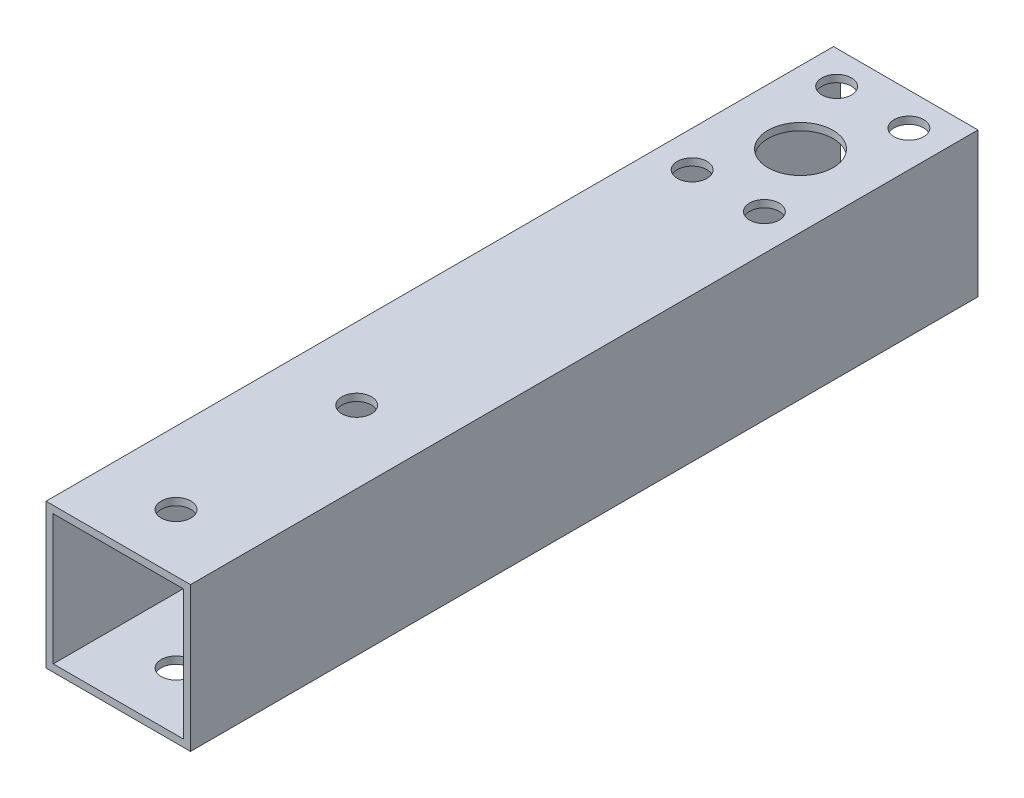
from build123d import *

# Parameters (mm, degrees)
SKETCH_1_2_W         = 20
SKETCH_1_2_H         = 20
SKETCH_1_2_W_2       = 18
SKETCH_1_2_H_2       = 18
EXTRUDE_2_DEPTH      = 54.5
SKETCH_2_R           = 2.05
CUT_EXTRUDE_1_DEPTH  = 102
SKETCH_11_R          = 2.05
CUT_EXTRUDE_8_DEPTH  = 50
SKETCH_17_R          = 4.5
CUT_EXTRUDE_14_DEPTH = 40


with BuildPart() as part:
    # 草图1<2> → 凸台-拉伸2 (new, symmetric)
    with BuildSketch(Plane.XY):
        Rectangle(SKETCH_1_2_W, SKETCH_1_2_H)
        Rectangle(SKETCH_1_2_W_2, SKETCH_1_2_H_2, mode=Mode.SUBTRACT)
    extrude(amount=EXTRUDE_2_DEPTH, both=True)

    # 草图2 → 切除-拉伸1 (cut)
    with BuildSketch(Plane(origin=(0, 10, 0), x_dir=(1, 0, 0), z_dir=(0, 1, 0))):
        with Locations((0, -46.5)):
            Circle(SKETCH_2_R)
        with Locations((0, -21.5)):
            Circle(SKETCH_2_R)
    extrude(amount=-CUT_EXTRUDE_1_DEPTH, mode=Mode.SUBTRACT)

    # 草图11 → 切除-拉伸8 (cut)
    with BuildSketch(Plane(origin=(0, 10, 0), x_dir=(1, 0, 0), z_dir=(0, 1, 0))):
        with Locations((5, 29.933387088)):
            Circle(SKETCH_11_R)
        with Locations((-5, 29.933387088)):
            Circle(SKETCH_11_R)
        with Locations((5, 49.933387088)):
            Circle(SKETCH_11_R)
        with Locations((-5, 49.933387088)):
            Circle(SKETCH_11_R)
    extrude(amount=-CUT_EXTRUDE_8_DEPTH, mode=Mode.SUBTRACT)

    # 草图17 → 切除-拉伸14 (cut)
    with BuildSketch(Plane(origin=(0, 10, 0), x_dir=(1, 0, 0), z_dir=(0, 1, 0))):
        with Locations((0, 39.933387088)):
            Circle(SKETCH_17_R)
    extrude(amount=-CUT_EXTRUDE_14_DEPTH, mode=Mode.SUBTRACT)


solid = part.part
